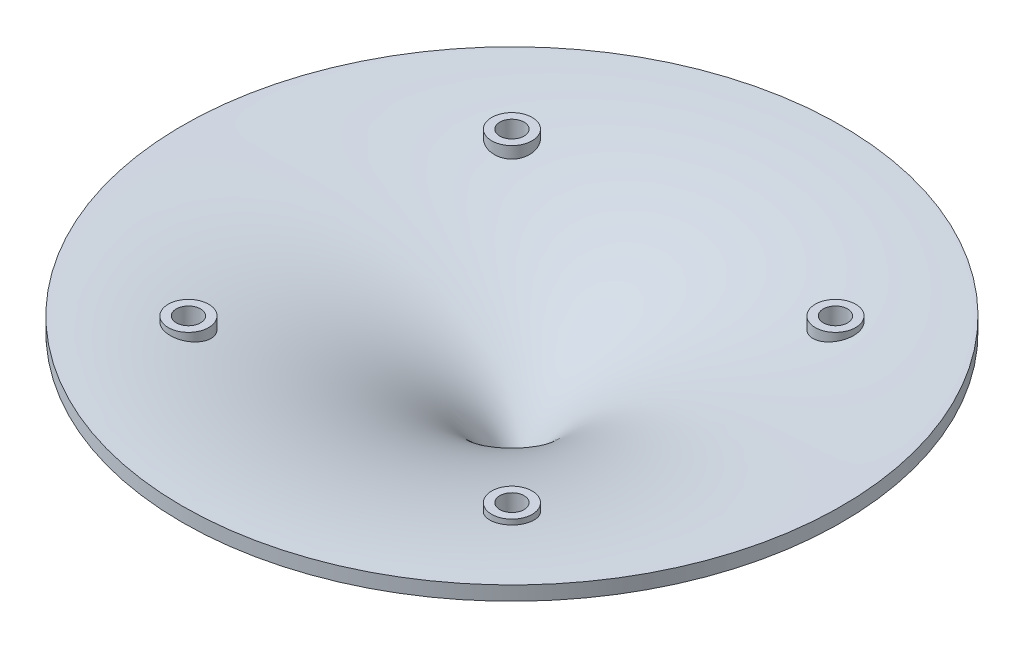
from build123d import *

# Parameters (mm, degrees)
SKETCH2_R           = 3
CUT_EXTRUDE3_DEPTH  = 100
BOSS_EXTRUDE1_REACH = 129.709
SKETCH3_R           = 5
SKETCH3_R_2         = 3


with BuildPart() as part:
    # Sketch1 → Revolve1 (revolve)
    with BuildSketch(Plane.XY, mode=Mode.PRIVATE) as revolve1_sk:
        with BuildLine():
            Line((3.8, 0), (3.8, -15))
            Line((3.8, -15), (1.5, -15))
            Line((1.5, -15), (1.5, 0))
            add(Edge.make_bspline(
                [(81.5, 40), (1.5, 40), (1.5, 0)],
                knots=[4.71238898, 4.71238898, 4.71238898, 6.283185307, 6.283185307, 6.283185307], degree=2, weights=[1, 0.707106781, 1]))
            Line((81.5, 40), (81.5, 36.5))
            add(Edge.make_bspline(
                [(3.8, 0), (3.8, 6.33566197), (17.718114252, 21.385939358), (45.345693135, 33.248700069), (66.206013583, 36.5), (81.5, 36.5)],
                knots=[0, 0, 0, 0, 0.319283378, 0.419283378, 1, 1, 1, 1], degree=3))
        make_face()
    revolve(revolve1_sk.sketch.rotate(Axis((0, 59.506196768, 0), (0, -1, 0)), 90), axis=Axis((0, 59.506196768, 0), (0, -1, 0)))

    # Sketch2 → Cut-Extrude3 (cut)
    with BuildSketch(Plane(origin=(0, 0, 0), x_dir=(1, 0, 0), z_dir=(0, 1, 0))):
        with Locations(Location((-40, 40, 0), (0, 0, 90))):
            Circle(SKETCH2_R)
        with Locations(Location((40, 40, 0), (0, 0, 90))):
            Circle(SKETCH2_R)
        with Locations(Location((40, -40, 0), (0, 0, 90))):
            Circle(SKETCH2_R)
        with Locations(Location((-40, -40, 0), (0, 0, 90))):
            Circle(SKETCH2_R)
    extrude(amount=CUT_EXTRUDE3_DEPTH, mode=Mode.SUBTRACT)

    # Sketch3 → Boss-Extrude1 (add, up to next)
    with BuildSketch(Plane(origin=(0, 40, 0), x_dir=(1, 0, 0), z_dir=(0, 1, 0)), mode=Mode.PRIVATE) as boss_extrude1_sk1:
        with Locations(Location((40, 40, 0), (0, 0, 270))):
            Circle(SKETCH3_R)
        with Locations(Location((40, 40, 0), (0, 0, 90))):
            Circle(SKETCH3_R_2, mode=Mode.SUBTRACT)
    boss_extrude1_tool1 = extrude(boss_extrude1_sk1.sketch, amount=-BOSS_EXTRUDE1_REACH, mode=Mode.PRIVATE) - part.part
    # Sketch3 → Boss-Extrude1 (add, up to next)
    with BuildSketch(Plane(origin=(0, 40, 0), x_dir=(1, 0, 0), z_dir=(0, 1, 0)), mode=Mode.PRIVATE) as boss_extrude1_sk2:
        with Locations(Location((-40, 40, 0), (0, 0, 270))):
            Circle(SKETCH3_R)
        with Locations(Location((-40, 40, 0), (0, 0, 90))):
            Circle(SKETCH3_R_2, mode=Mode.SUBTRACT)
    boss_extrude1_tool2 = extrude(boss_extrude1_sk2.sketch, amount=-BOSS_EXTRUDE1_REACH, mode=Mode.PRIVATE) - part.part
    # Sketch3 → Boss-Extrude1 (add, up to next)
    with BuildSketch(Plane(origin=(0, 40, 0), x_dir=(1, 0, 0), z_dir=(0, 1, 0)), mode=Mode.PRIVATE) as boss_extrude1_sk3:
        with Locations(Location((-40, -40, 0), (0, 0, 270))):
            Circle(SKETCH3_R)
        with Locations(Location((-40, -40, 0), (0, 0, 90))):
            Circle(SKETCH3_R_2, mode=Mode.SUBTRACT)
    boss_extrude1_tool3 = extrude(boss_extrude1_sk3.sketch, amount=-BOSS_EXTRUDE1_REACH, mode=Mode.PRIVATE) - part.part
    # Sketch3 → Boss-Extrude1 (add, up to next)
    with BuildSketch(Plane(origin=(0, 40, 0), x_dir=(1, 0, 0), z_dir=(0, 1, 0)), mode=Mode.PRIVATE) as boss_extrude1_sk4:
        with Locations(Location((40, -40, 0), (0, 0, 270))):
            Circle(SKETCH3_R)
        with Locations(Location((40, -40, 0), (0, 0, 90))):
            Circle(SKETCH3_R_2, mode=Mode.SUBTRACT)
    boss_extrude1_tool4 = extrude(boss_extrude1_sk4.sketch, amount=-BOSS_EXTRUDE1_REACH, mode=Mode.PRIVATE) - part.part
    add(boss_extrude1_tool1.solids().sort_by_distance((40, 40, -44.858579))[0])
    add(boss_extrude1_tool2.solids().sort_by_distance((-40, 40, -44.858579))[0])
    add(boss_extrude1_tool3.solids().sort_by_distance((-40, 40, 35.141421))[0])
    add(boss_extrude1_tool4.solids().sort_by_distance((40, 40, 35.141421))[0])


solid = part.part
